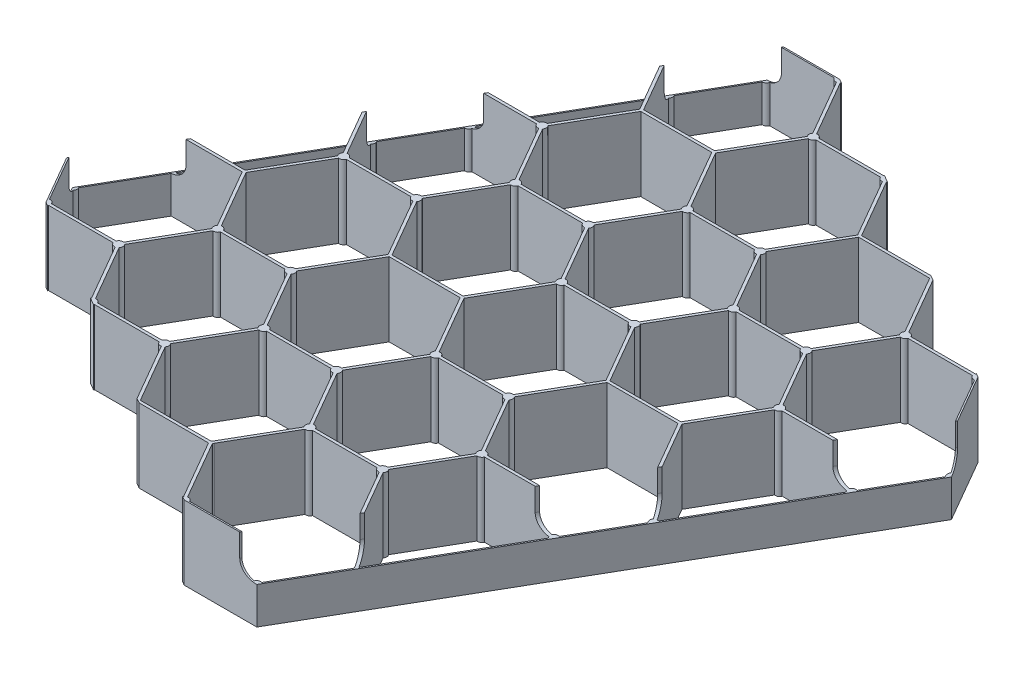
from build123d import *

# Parameters (mm, degrees)
BOSS_EXTRUDE1_DEPTH     = 26
BOSS_EXTRUDE2_DEPTH     = 30
CUT_EXTRUDE1_DEPTH      = 291.731919046
CUT_EXTRUDE1_DEPTH_BACK = 291.731919046
SKETCH5_W               = 21.517935058
SKETCH5_H               = 30
CUT_EXTRUDE2_DEPTH      = 30


with BuildPart() as part:
    # Sketch2 → Boss-Extrude1 (new body)
    with BuildSketch(Plane(origin=(0, 0, 0), x_dir=(1, 0, 0), z_dir=(0, 1, 0))):
        with BuildLine():
            Line((51.154700538, 44.301270189), (64.232050808, 66.951905284))
            Line((64.232050808, 66.951905284), (88.770725942, 109.454137367))
            Line((88.770725942, 109.454137367), (127.136751346, 175.906042651))
            Line((127.136751346, 175.906042651), (140.675426481, 199.355715851))
            Line((140.675426481, 199.355715851), (127.886751346, 221.506350946))
            Line((127.886751346, 221.506350946), (126.58771324, 222.256350946))
            ThreePointArc((126.58771324, 222.256350946), (126.52437891, 222.133998416), (126.472537784, 222.006350946))
            Line((126.472537784, 222.006350946), (103.723614639, 222.006350946))
            ThreePointArc((103.723614639, 222.006350946), (103.059401077, 222.805389052), (102.035306997, 222.981095818))
            Line((102.035306997, 222.981095818), (90.386751346, 243.156986041))
            Line((90.386751346, 243.156986041), (88.654700538, 244.156986041))
            Line((88.654700538, 244.156986041), (64.232050808, 244.156986041))
            Line((64.232050808, 244.156986041), (52.294820021, 264.832876264))
            ThreePointArc((52.294820021, 264.832876264), (52.37944541, 264.941595732), (52.453738644, 265.057621135))
            Line((52.453738644, 265.057621135), (49.855662433, 266.557621135))
            ThreePointArc((49.855662433, 266.557621135), (49.792328103, 266.435268605), (49.740486976, 266.307621135))
            Line((49.740486976, 266.307621135), (26.991563832, 266.307621135))
            ThreePointArc((26.991563832, 266.307621135), (26.327350269, 267.106659241), (25.30325619, 267.282366007))
            Line((25.30325619, 267.282366007), (13.928794618, 286.983511359))
            ThreePointArc((13.928794618, 286.983511359), (14.013420006, 287.092230826), (14.08771324, 287.20825623))
            Line((14.08771324, 287.20825623), (12.788675135, 287.95825623))
            Line((12.788675135, 287.95825623), (-12.788675135, 287.95825623))
            Line((-12.788675135, 287.95825623), (-26.327350269, 264.50858303))
            Line((-26.327350269, 264.50858303), (-50.404700538, 222.805389052))
            Line((-50.404700538, 222.805389052), (-64.693375673, 198.056677746))
            Line((-64.693375673, 198.056677746), (-89.232050808, 155.554445662))
            Line((-89.232050808, 155.554445662), (-102.309401077, 132.903810568))
            Line((-102.309401077, 132.903810568), (-89.520725942, 110.753175473))
            Line((-89.520725942, 110.753175473), (-88.221687836, 110.003175473))
            ThreePointArc((-88.221687836, 110.003175473), (-88.158353506, 110.125528003), (-88.10651238, 110.253175473))
            Line((-88.10651238, 110.253175473), (-65.357589235, 110.253175473))
            ThreePointArc((-65.357589235, 110.253175473), (-64.693375673, 109.454137367), (-63.669281594, 109.278430602))
            Line((-63.669281594, 109.278430602), (-52.294820021, 89.57728525))
            ThreePointArc((-52.294820021, 89.57728525), (-52.37944541, 89.468565782), (-52.453738644, 89.352540378))
            Line((-52.453738644, 89.352540378), (-49.855662433, 87.852540378))
            ThreePointArc((-49.855662433, 87.852540378), (-49.792328103, 87.974892909), (-49.740486976, 88.102540378))
            Line((-49.740486976, 88.102540378), (-26.991563832, 88.102540378))
            ThreePointArc((-26.991563832, 88.102540378), (-26.327350269, 87.303502273), (-25.30325619, 87.127795507))
            Line((-25.30325619, 87.127795507), (-13.654700538, 66.951905284))
            Line((-13.654700538, 66.951905284), (-11.922649731, 65.951905284))
            Line((-11.922649731, 65.951905284), (12.5, 65.951905284))
            Line((12.5, 65.951905284), (24.437230786, 45.276015061))
            ThreePointArc((24.437230786, 45.276015061), (24.352605398, 45.167295593), (24.278312164, 45.051270189))
            Line((24.278312164, 45.051270189), (25.577350269, 44.301270189))
            Line((25.577350269, 44.301270189), (27.077350269, 44.301270189))
            Line((27.077350269, 44.301270189), (51.154700538, 44.301270189))
        make_face()
        with BuildLine():
            ThreePointArc((-25.30325619, 90.07728525), (-26.327350269, 89.901578484), (-26.991563832, 89.102540378))
            Line((-26.991563832, 89.102540378), (-49.740486976, 89.102540378))
            ThreePointArc((-49.740486976, 89.102540378), (-50.404700538, 89.901578484), (-51.428794618, 90.07728525))
            Line((-51.428794618, 90.07728525), (-62.80325619, 109.778430602))
            ThreePointArc((-62.80325619, 109.778430602), (-62.443375673, 110.753175473), (-62.80325619, 111.727920344))
            Line((-62.80325619, 111.727920344), (-51.428794618, 131.429065696))
            ThreePointArc((-51.428794618, 131.429065696), (-50.404700538, 131.604772462), (-49.740486976, 132.403810568))
            Line((-49.740486976, 132.403810568), (-26.991563832, 132.403810568))
            ThreePointArc((-26.991563832, 132.403810568), (-26.327350269, 131.604772462), (-25.30325619, 131.429065696))
            Line((-25.30325619, 131.429065696), (-13.928794618, 111.727920344))
            ThreePointArc((-13.928794618, 111.727920344), (-14.288675135, 110.753175473), (-13.928794618, 109.778430602))
            Line((-13.928794618, 109.778430602), (-25.30325619, 90.07728525))
        make_face(mode=Mode.SUBTRACT)
        with BuildLine():
            Line((-101.169281594, 133.878555439), (-89.232050808, 154.554445662))
            Line((-89.232050808, 154.554445662), (-64.232050808, 154.554445662))
            Line((-64.232050808, 154.554445662), (-52.294820021, 133.878555439))
            ThreePointArc((-52.294820021, 133.878555439), (-52.654700538, 132.903810568), (-52.294820021, 131.929065696))
            Line((-52.294820021, 131.929065696), (-63.669281594, 112.227920344))
            ThreePointArc((-63.669281594, 112.227920344), (-64.693375673, 112.052213579), (-65.357589235, 111.253175473))
            Line((-65.357589235, 111.253175473), (-88.10651238, 111.253175473))
            ThreePointArc((-88.10651238, 111.253175473), (-88.770725942, 112.052213579), (-89.794820021, 112.227920344))
            Line((-89.794820021, 112.227920344), (-101.169281594, 131.929065696))
            ThreePointArc((-101.169281594, 131.929065696), (-100.809401077, 132.903810568), (-101.169281594, 133.878555439))
        make_face(mode=Mode.SUBTRACT)
        with BuildLine():
            ThreePointArc((-11.374461572, 111.253175473), (-12.038675135, 112.052213579), (-13.062769214, 112.227920344))
            Line((-13.062769214, 112.227920344), (-24.437230786, 131.929065696))
            ThreePointArc((-24.437230786, 131.929065696), (-24.077350269, 132.903810568), (-24.437230786, 133.878555439))
            Line((-24.437230786, 133.878555439), (-12.5, 154.554445662))
            Line((-12.5, 154.554445662), (12.5, 154.554445662))
            Line((12.5, 154.554445662), (24.437230786, 133.878555439))
            ThreePointArc((24.437230786, 133.878555439), (24.077350269, 132.903810568), (24.437230786, 131.929065696))
            Line((24.437230786, 131.929065696), (13.062769214, 112.227920344))
            ThreePointArc((13.062769214, 112.227920344), (12.038675135, 112.052213579), (11.374461572, 111.253175473))
            Line((11.374461572, 111.253175473), (-11.374461572, 111.253175473))
        make_face(mode=Mode.SUBTRACT)
        with BuildLine():
            ThreePointArc((25.30325619, 87.127795507), (26.327350269, 87.303502273), (26.991563832, 88.102540378))
            Line((26.991563832, 88.102540378), (49.740486976, 88.102540378))
            ThreePointArc((49.740486976, 88.102540378), (50.404700538, 87.303502273), (51.428794618, 87.127795507))
            Line((51.428794618, 87.127795507), (63.077350269, 66.951905284))
            Line((63.077350269, 66.951905284), (63.35269207, 66.451905284))
            Line((63.35269207, 66.451905284), (63.077350269, 65.951905284))
            Line((63.077350269, 65.951905284), (51.428794618, 45.776015061))
            ThreePointArc((51.428794618, 45.776015061), (50.404700538, 45.600308295), (49.740486976, 44.801270189))
            Line((49.740486976, 44.801270189), (26.991563832, 44.801270189))
            ThreePointArc((26.991563832, 44.801270189), (26.327350269, 45.600308295), (25.30325619, 45.776015061))
            Line((25.30325619, 45.776015061), (13.654700538, 65.951905284))
            Line((13.654700538, 65.951905284), (13.379358737, 66.451905284))
            Line((13.379358737, 66.451905284), (13.654700538, 66.951905284))
            Line((13.654700538, 66.951905284), (25.30325619, 87.127795507))
        make_face(mode=Mode.SUBTRACT)
        with BuildLine():
            Line((-24.437230786, 89.57728525), (-13.062769214, 109.278430602))
            ThreePointArc((-13.062769214, 109.278430602), (-12.038675135, 109.454137367), (-11.374461572, 110.253175473))
            Line((-11.374461572, 110.253175473), (11.374461572, 110.253175473))
            ThreePointArc((11.374461572, 110.253175473), (12.038675135, 109.454137367), (13.062769214, 109.278430602))
            Line((13.062769214, 109.278430602), (24.437230786, 89.57728525))
            ThreePointArc((24.437230786, 89.57728525), (24.077350269, 88.602540378), (24.437230786, 87.627795507))
            Line((24.437230786, 87.627795507), (12.5, 66.951905284))
            Line((12.5, 66.951905284), (-12.5, 66.951905284))
            Line((-12.5, 66.951905284), (-24.437230786, 87.627795507))
            ThreePointArc((-24.437230786, 87.627795507), (-24.077350269, 88.602540378), (-24.437230786, 89.57728525))
        make_face(mode=Mode.SUBTRACT)
        with BuildLine():
            ThreePointArc((25.30325619, 131.429065696), (26.327350269, 131.604772462), (26.991563832, 132.403810568))
            Line((26.991563832, 132.403810568), (49.740486976, 132.403810568))
            ThreePointArc((49.740486976, 132.403810568), (50.404700538, 131.604772462), (51.428794618, 131.429065696))
            Line((51.428794618, 131.429065696), (62.80325619, 111.727920344))
            ThreePointArc((62.80325619, 111.727920344), (62.443375673, 110.753175473), (62.80325619, 109.778430602))
            Line((62.80325619, 109.778430602), (51.428794618, 90.07728525))
            ThreePointArc((51.428794618, 90.07728525), (50.404700538, 89.901578484), (49.740486976, 89.102540378))
            Line((49.740486976, 89.102540378), (26.991563832, 89.102540378))
            ThreePointArc((26.991563832, 89.102540378), (26.327350269, 89.901578484), (25.30325619, 90.07728525))
            Line((25.30325619, 90.07728525), (13.928794618, 109.778430602))
            ThreePointArc((13.928794618, 109.778430602), (14.288675135, 110.753175473), (13.928794618, 111.727920344))
            Line((13.928794618, 111.727920344), (25.30325619, 131.429065696))
        make_face(mode=Mode.SUBTRACT)
        with BuildLine():
            ThreePointArc((63.669281594, 109.278430602), (64.693375673, 109.454137367), (65.357589235, 110.253175473))
            Line((65.357589235, 110.253175473), (88.10651238, 110.253175473))
            ThreePointArc((88.10651238, 110.253175473), (88.219810601, 110.006436379), (88.375730663, 109.784162671))
            Line((88.375730663, 109.784162671), (63.936769089, 67.463348223))
            Line((63.936769089, 67.463348223), (52.294820021, 87.627795507))
            ThreePointArc((52.294820021, 87.627795507), (52.654700538, 88.602540378), (52.294820021, 89.57728525))
            Line((52.294820021, 89.57728525), (63.669281594, 109.278430602))
        make_face(mode=Mode.SUBTRACT)
        with BuildLine():
            Line((52.294820021, 133.878555439), (64.232050808, 154.554445662))
            Line((64.232050808, 154.554445662), (89.232050808, 154.554445662))
            Line((89.232050808, 154.554445662), (101.169281594, 133.878555439))
            ThreePointArc((101.169281594, 133.878555439), (100.809403248, 132.906362853), (101.165971097, 131.932951215))
            ThreePointArc((101.165971097, 131.932951215), (101.167624693, 131.931007048), (101.169281594, 131.929065696))
            Line((101.169281594, 131.929065696), (89.794820021, 112.227920344))
            ThreePointArc((89.794820021, 112.227920344), (89.791251324, 112.228579153), (89.787681042, 112.229229325))
            ThreePointArc((89.787681042, 112.229229325), (88.767585334, 112.050395279), (88.10651238, 111.253175473))
            Line((88.10651238, 111.253175473), (65.357589235, 111.253175473))
            ThreePointArc((65.357589235, 111.253175473), (64.693375673, 112.052213579), (63.669281594, 112.227920344))
            Line((63.669281594, 112.227920344), (52.294820021, 131.929065696))
            ThreePointArc((52.294820021, 131.929065696), (52.654700538, 132.903810568), (52.294820021, 133.878555439))
        make_face(mode=Mode.SUBTRACT)
        with BuildLine():
            Line((-52.294820021, 176.230335885), (-64.232050808, 155.554445662))
            Line((-64.232050808, 155.554445662), (-88.654700538, 155.554445662))
            Line((-88.654700538, 155.554445662), (-64.217469752, 197.88097098))
            ThreePointArc((-64.217469752, 197.88097098), (-63.943375673, 197.855715851), (-63.669281594, 197.88097098))
            Line((-63.669281594, 197.88097098), (-52.294820021, 178.179825628))
            ThreePointArc((-52.294820021, 178.179825628), (-52.654700538, 177.205080757), (-52.294820021, 176.230335885))
        make_face(mode=Mode.SUBTRACT)
        with BuildLine():
            ThreePointArc((-25.30325619, 134.378555439), (-26.327350269, 134.202848673), (-26.991563832, 133.403810568))
            Line((-26.991563832, 133.403810568), (-49.740486976, 133.403810568))
            ThreePointArc((-49.740486976, 133.403810568), (-50.404700538, 134.202848673), (-51.428794618, 134.378555439))
            Line((-51.428794618, 134.378555439), (-63.366025404, 155.054445662))
            Line((-63.366025404, 155.054445662), (-51.428794618, 175.730335885))
            ThreePointArc((-51.428794618, 175.730335885), (-50.404700538, 175.906042651), (-49.740486976, 176.705080757))
            Line((-49.740486976, 176.705080757), (-26.991563832, 176.705080757))
            ThreePointArc((-26.991563832, 176.705080757), (-26.327350269, 175.906042651), (-25.30325619, 175.730335885))
            Line((-25.30325619, 175.730335885), (-13.654700538, 155.554445662))
            Line((-13.654700538, 155.554445662), (-13.366025404, 155.054445662))
            Line((-13.366025404, 155.054445662), (-13.654700538, 154.554445662))
            Line((-13.654700538, 154.554445662), (-25.30325619, 134.378555439))
        make_face(mode=Mode.SUBTRACT)
        with BuildLine():
            Line((-12.5, 155.554445662), (-24.437230786, 176.230335885))
            ThreePointArc((-24.437230786, 176.230335885), (-24.077350269, 177.205080757), (-24.437230786, 178.179825628))
            Line((-24.437230786, 178.179825628), (-13.062769214, 197.88097098))
            ThreePointArc((-13.062769214, 197.88097098), (-12.038675135, 198.056677746), (-11.374461572, 198.855715851))
            Line((-11.374461572, 198.855715851), (11.374461572, 198.855715851))
            ThreePointArc((11.374461572, 198.855715851), (12.038675135, 198.056677746), (13.062769214, 197.88097098))
            Line((13.062769214, 197.88097098), (24.437230786, 178.179825628))
            ThreePointArc((24.437230786, 178.179825628), (24.077350269, 177.205080757), (24.437230786, 176.230335885))
            Line((24.437230786, 176.230335885), (12.5, 155.554445662))
            Line((12.5, 155.554445662), (-12.5, 155.554445662))
        make_face(mode=Mode.SUBTRACT)
        with BuildLine():
            ThreePointArc((-25.30325619, 178.679825628), (-26.327350269, 178.504118863), (-26.991563832, 177.705080757))
            Line((-26.991563832, 177.705080757), (-49.740486976, 177.705080757))
            ThreePointArc((-49.740486976, 177.705080757), (-50.404700538, 178.504118863), (-51.428794618, 178.679825628))
            Line((-51.428794618, 178.679825628), (-62.80325619, 198.38097098))
            ThreePointArc((-62.80325619, 198.38097098), (-62.443375673, 199.355715851), (-62.80325619, 200.330460723))
            Line((-62.80325619, 200.330460723), (-51.428794618, 220.031606075))
            ThreePointArc((-51.428794618, 220.031606075), (-50.404700538, 220.20731284), (-49.740486976, 221.006350946))
            Line((-49.740486976, 221.006350946), (-26.991563832, 221.006350946))
            ThreePointArc((-26.991563832, 221.006350946), (-26.327350269, 220.20731284), (-25.30325619, 220.031606075))
            Line((-25.30325619, 220.031606075), (-13.928794618, 200.330460723))
            ThreePointArc((-13.928794618, 200.330460723), (-14.288675135, 199.355715851), (-13.928794618, 198.38097098))
            Line((-13.928794618, 198.38097098), (-25.30325619, 178.679825628))
        make_face(mode=Mode.SUBTRACT)
        with BuildLine():
            ThreePointArc((-25.30325619, 222.981095818), (-26.327350269, 222.805389052), (-26.991563832, 222.006350946))
            Line((-26.991563832, 222.006350946), (-49.740486976, 222.006350946))
            ThreePointArc((-49.740486976, 222.006350946), (-49.855662433, 222.256350946), (-50.014581055, 222.481095818))
            Line((-50.014581055, 222.481095818), (-25.851444348, 264.332876264))
            ThreePointArc((-25.851444348, 264.332876264), (-25.577350269, 264.307621135), (-25.30325619, 264.332876264))
            Line((-25.30325619, 264.332876264), (-13.366025404, 243.656986041))
            Line((-13.366025404, 243.656986041), (-25.30325619, 222.981095818))
        make_face(mode=Mode.SUBTRACT)
        with BuildLine():
            ThreePointArc((-24.437230786, 220.531606075), (-24.077350269, 221.506350946), (-24.437230786, 222.481095818))
            Line((-24.437230786, 222.481095818), (-12.5, 243.156986041))
            Line((-12.5, 243.156986041), (12.5, 243.156986041))
            Line((12.5, 243.156986041), (24.437230786, 222.481095818))
            ThreePointArc((24.437230786, 222.481095818), (24.077350269, 221.506350946), (24.437230786, 220.531606075))
            Line((24.437230786, 220.531606075), (13.062769214, 200.830460723))
            ThreePointArc((13.062769214, 200.830460723), (12.038675135, 200.654753957), (11.374461572, 199.855715851))
            Line((11.374461572, 199.855715851), (-11.374461572, 199.855715851))
            ThreePointArc((-11.374461572, 199.855715851), (-12.038675135, 200.654753957), (-13.062769214, 200.830460723))
            Line((-13.062769214, 200.830460723), (-24.437230786, 220.531606075))
        make_face(mode=Mode.SUBTRACT)
        with BuildLine():
            Line((13.062769214, 286.483511359), (24.437230786, 266.782366007))
            ThreePointArc((24.437230786, 266.782366007), (24.077350269, 265.807621135), (24.437230786, 264.832876264))
            Line((24.437230786, 264.832876264), (12.5, 244.156986041))
            Line((12.5, 244.156986041), (-12.5, 244.156986041))
            Line((-12.5, 244.156986041), (-24.437230786, 264.832876264))
            ThreePointArc((-24.437230786, 264.832876264), (-24.077350269, 265.807621135), (-24.437230786, 266.782366007))
            Line((-24.437230786, 266.782366007), (-13.062769214, 286.483511359))
            ThreePointArc((-13.062769214, 286.483511359), (-12.038675135, 286.659218124), (-11.374461572, 287.45825623))
            Line((-11.374461572, 287.45825623), (11.374461572, 287.45825623))
            ThreePointArc((11.374461572, 287.45825623), (12.038675135, 286.659218124), (13.062769214, 286.483511359))
        make_face(mode=Mode.SUBTRACT)
        with BuildLine():
            ThreePointArc((25.30325619, 175.730335885), (26.327350269, 175.906042651), (26.991563832, 176.705080757))
            Line((26.991563832, 176.705080757), (49.740486976, 176.705080757))
            ThreePointArc((49.740486976, 176.705080757), (50.404700538, 175.906042651), (51.428794618, 175.730335885))
            Line((51.428794618, 175.730335885), (63.366025404, 155.054445662))
            Line((63.366025404, 155.054445662), (51.428794618, 134.378555439))
            ThreePointArc((51.428794618, 134.378555439), (50.404700538, 134.202848673), (49.740486976, 133.403810568))
            Line((49.740486976, 133.403810568), (26.991563832, 133.403810568))
            ThreePointArc((26.991563832, 133.403810568), (26.327350269, 134.202848673), (25.30325619, 134.378555439))
            Line((25.30325619, 134.378555439), (13.654700538, 154.554445662))
            Line((13.654700538, 154.554445662), (13.366025404, 155.054445662))
            Line((13.366025404, 155.054445662), (13.654700538, 155.554445662))
            Line((13.654700538, 155.554445662), (25.30325619, 175.730335885))
        make_face(mode=Mode.SUBTRACT)
        with BuildLine():
            Line((101.169281594, 176.230335885), (89.232050808, 155.554445662))
            Line((89.232050808, 155.554445662), (64.232050808, 155.554445662))
            Line((64.232050808, 155.554445662), (52.294820021, 176.230335885))
            ThreePointArc((52.294820021, 176.230335885), (52.654700538, 177.205080757), (52.294820021, 178.179825628))
            Line((52.294820021, 178.179825628), (63.669281594, 197.88097098))
            ThreePointArc((63.669281594, 197.88097098), (64.693375673, 198.056677746), (65.357589235, 198.855715851))
            Line((65.357589235, 198.855715851), (88.10651238, 198.855715851))
            ThreePointArc((88.10651238, 198.855715851), (88.770725942, 198.056677746), (89.794820021, 197.88097098))
            Line((89.794820021, 197.88097098), (101.169281594, 178.179825628))
            ThreePointArc((101.169281594, 178.179825628), (100.809401077, 177.205080757), (101.169281594, 176.230335885))
        make_face(mode=Mode.SUBTRACT)
        with BuildLine():
            ThreePointArc((25.30325619, 220.031606075), (26.327350269, 220.20731284), (26.991563832, 221.006350946))
            Line((26.991563832, 221.006350946), (49.740486976, 221.006350946))
            ThreePointArc((49.740486976, 221.006350946), (50.404700538, 220.20731284), (51.428794618, 220.031606075))
            Line((51.428794618, 220.031606075), (62.80325619, 200.330460723))
            ThreePointArc((62.80325619, 200.330460723), (62.443375673, 199.355715851), (62.80325619, 198.38097098))
            Line((62.80325619, 198.38097098), (51.428794618, 178.679825628))
            ThreePointArc((51.428794618, 178.679825628), (50.404700538, 178.504118863), (49.740486976, 177.705080757))
            Line((49.740486976, 177.705080757), (26.991563832, 177.705080757))
            ThreePointArc((26.991563832, 177.705080757), (26.327350269, 178.504118863), (25.30325619, 178.679825628))
            Line((25.30325619, 178.679825628), (13.928794618, 198.38097098))
            ThreePointArc((13.928794618, 198.38097098), (14.288675135, 199.355715851), (13.928794618, 200.330460723))
            Line((13.928794618, 200.330460723), (25.30325619, 220.031606075))
        make_face(mode=Mode.SUBTRACT)
        with BuildLine():
            Line((64.232050808, 243.156986041), (89.232050808, 243.156986041))
            Line((89.232050808, 243.156986041), (101.169281594, 222.481095818))
            ThreePointArc((101.169281594, 222.481095818), (100.809401077, 221.506350946), (101.169281594, 220.531606075))
            Line((101.169281594, 220.531606075), (89.794820021, 200.830460723))
            ThreePointArc((89.794820021, 200.830460723), (88.770725942, 200.654753957), (88.10651238, 199.855715851))
            Line((88.10651238, 199.855715851), (65.357589235, 199.855715851))
            ThreePointArc((65.357589235, 199.855715851), (64.693375673, 200.654753957), (63.669281594, 200.830460723))
            Line((63.669281594, 200.830460723), (52.294820021, 220.531606075))
            ThreePointArc((52.294820021, 220.531606075), (52.654700538, 221.506350946), (52.294820021, 222.481095818))
            Line((52.294820021, 222.481095818), (64.232050808, 243.156986041))
        make_face(mode=Mode.SUBTRACT)
        with BuildLine():
            Line((102.035306997, 134.378555439), (90.098076211, 155.054445662))
            Line((90.098076211, 155.054445662), (102.035306997, 175.730335885))
            ThreePointArc((102.035306997, 175.730335885), (103.059401077, 175.906042651), (103.723614639, 176.705080757))
            Line((103.723614639, 176.705080757), (126.472537784, 176.705080757))
            ThreePointArc((126.472537784, 176.705080757), (126.587646421, 176.455196504), (126.746458182, 176.23053907))
            Line((126.746458182, 176.23053907), (102.578737909, 134.379431681))
            ThreePointArc((102.578737909, 134.379431681), (102.306982441, 134.403808618), (102.035306997, 134.378555439))
        make_face(mode=Mode.SUBTRACT)
        with BuildLine():
            ThreePointArc((102.035306997, 220.031606075), (103.059401077, 220.20731284), (103.723614639, 221.006350946))
            Line((103.723614639, 221.006350946), (126.472537784, 221.006350946))
            ThreePointArc((126.472537784, 221.006350946), (127.136751346, 220.20731284), (128.160845425, 220.031606075))
            Line((128.160845425, 220.031606075), (139.535306997, 200.330460723))
            ThreePointArc((139.535306997, 200.330460723), (139.175426481, 199.355715851), (139.535306997, 198.38097098))
            Line((139.535306997, 198.38097098), (128.160845425, 178.679825628))
            ThreePointArc((128.160845425, 178.679825628), (127.136751346, 178.504118863), (126.472537784, 177.705080757))
            Line((126.472537784, 177.705080757), (103.723614639, 177.705080757))
            ThreePointArc((103.723614639, 177.705080757), (103.059401077, 178.504118863), (102.035306997, 178.679825628))
            Line((102.035306997, 178.679825628), (90.660845425, 198.38097098))
            ThreePointArc((90.660845425, 198.38097098), (91.020725942, 199.355715851), (90.660845425, 200.330460723))
            Line((90.660845425, 200.330460723), (102.035306997, 220.031606075))
        make_face(mode=Mode.SUBTRACT)
        with BuildLine():
            ThreePointArc((25.30325619, 264.332876264), (26.327350269, 264.50858303), (26.991563832, 265.307621135))
            Line((26.991563832, 265.307621135), (49.740486976, 265.307621135))
            ThreePointArc((49.740486976, 265.307621135), (50.404700538, 264.50858303), (51.428794618, 264.332876264))
            Line((51.428794618, 264.332876264), (63.366025404, 243.656986041))
            Line((63.366025404, 243.656986041), (51.428794618, 222.981095818))
            ThreePointArc((51.428794618, 222.981095818), (50.404700538, 222.805389052), (49.740486976, 222.006350946))
            Line((49.740486976, 222.006350946), (26.991563832, 222.006350946))
            ThreePointArc((26.991563832, 222.006350946), (26.327350269, 222.805389052), (25.30325619, 222.981095818))
            Line((25.30325619, 222.981095818), (13.366025404, 243.656986041))
            Line((13.366025404, 243.656986041), (25.30325619, 264.332876264))
        make_face(mode=Mode.SUBTRACT)
    extrude(amount=BOSS_EXTRUDE1_DEPTH)

    # Sketch4 → Cut-Extrude1 (cut, two sides: drawn at the far end of the back side and taken through both)
    with BuildSketch(Plane(origin=(31.971687836, 0, -55.376587737), x_dir=(-0.8660254037844383, 0, -0.5000000000000009), z_dir=(0.5000000000000008, 0, -0.8660254037844382)).offset(-CUT_EXTRUDE1_DEPTH_BACK)):
        with BuildLine():
            Line((150.054445662, 18), (150.054445662, 32.761333926))
            Line((150.054445662, 32.761333926), (160.054445662, 32.761333926))
            Line((160.054445662, 32.761333926), (160.054445662, 18))
            ThreePointArc((160.054445662, 18), (155.054445662, 13), (150.054445662, 18))
        make_face()
        with BuildLine():
            Line((-16.945554338, 32.761333926), (-16.945554338, 18))
            ThreePointArc((-16.945554338, 18), (-21.945554338, 13), (-26.945554338, 18))
            Line((-26.945554338, 18), (-26.945554338, 32.761333926))
            Line((-26.945554338, 32.761333926), (-16.945554338, 32.761333926))
        make_face()
    extrude(amount=CUT_EXTRUDE1_DEPTH + CUT_EXTRUDE1_DEPTH_BACK, mode=Mode.SUBTRACT)


with BuildPart() as body_2:
    # Sketch3 → Boss-Extrude2 (new body)
    with BuildSketch(Plane(origin=(0, 26, 0), x_dir=(1, 0, 0), z_dir=(0, 1, 0))):
        Polygon((-121.88907787, 136.881733683), (-118.716649908, 142.376540097), (-137.351728305, 153.135507626), (-140.524156267, 147.640701212), align=None)
    extrude(amount=-BOSS_EXTRUDE2_DEPTH)

    # Sketch5 → Cut-Extrude2 (cut)
    with BuildSketch(Plane(origin=(28.799259874, 0, -49.881781323), x_dir=(0.8660254037844377, 0, 0.5000000000000018), z_dir=(-0.5000000000000018, 0, 0.8660254037844377))):
        with Locations((-184.75887225, 11)):
            Rectangle(SKETCH5_W, SKETCH5_H)
    extrude(amount=-CUT_EXTRUDE2_DEPTH, mode=Mode.SUBTRACT)


solid = part.part
